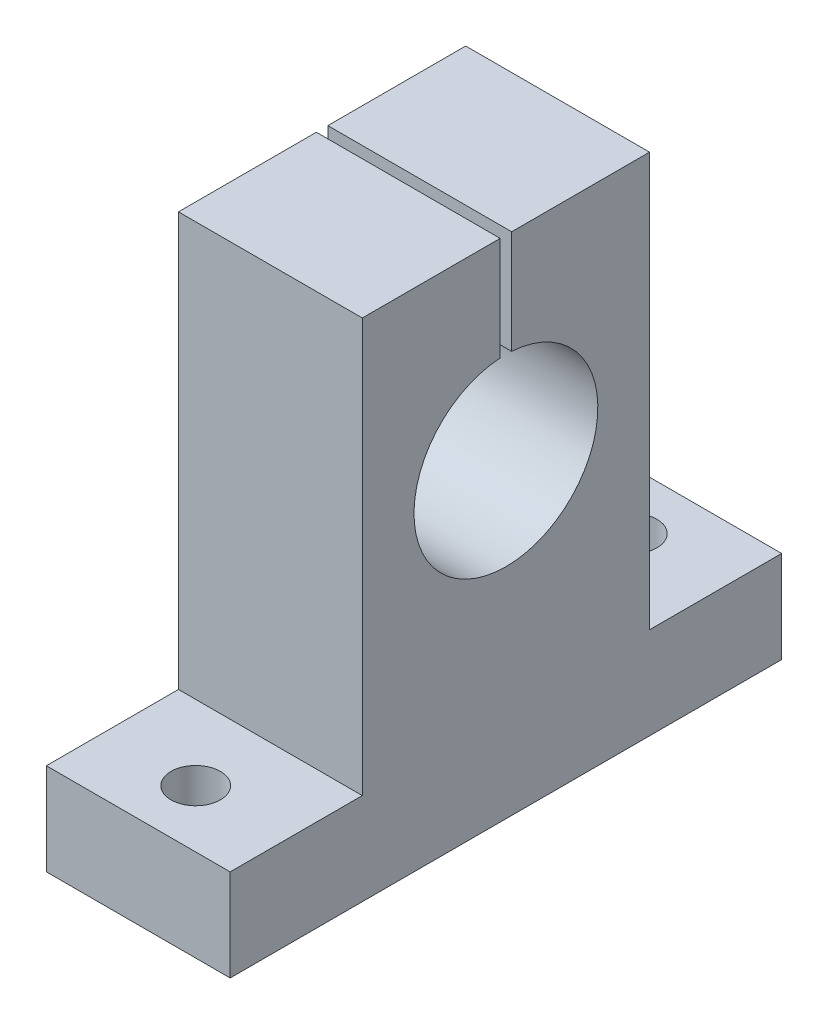
from build123d import *

# Parameters (mm, degrees)
BOSS_EXTRUDE1_DEPTH  = 16
M4_CLEARANCE_HOLE2_D = 4.3


with BuildPart() as part:
    # Sketch1 → Boss-Extrude1 (new body)
    with BuildSketch(Plane(origin=(0, 0, 0), x_dir=(0, 0, -1), z_dir=(1, 0, 0))):
        with BuildLine():
            Line((12.5, 8), (24, 8))
            Line((24, 8), (24, 0))
            Line((24, 0), (-24, 0))
            Line((-24, 0), (-24, 8))
            Line((-24, 8), (-12.5, 8))
            Line((-12.5, 8), (-12.5, 44))
            Line((-12.5, 44), (-0.5, 44))
            Line((-0.5, 44), (-0.5, 34.984359711))
            ThreePointArc((-0.5, 34.984359711), (0, 19), (0.5, 34.984359711))
            Line((0.5, 34.984359711), (0.5, 44))
            Line((0.5, 44), (12.5, 44))
            Line((12.5, 44), (12.5, 8))
        make_face()
    extrude(amount=BOSS_EXTRUDE1_DEPTH)

    # M4 Clearance Hole2 (through all)
    with Locations(Plane(origin=(0, 8, 0), x_dir=(1, 0, 0), z_dir=(0, 1, 0))):
        with Locations((8, 19), (8, -19)):
            Hole(M4_CLEARANCE_HOLE2_D / 2)


solid = part.part
